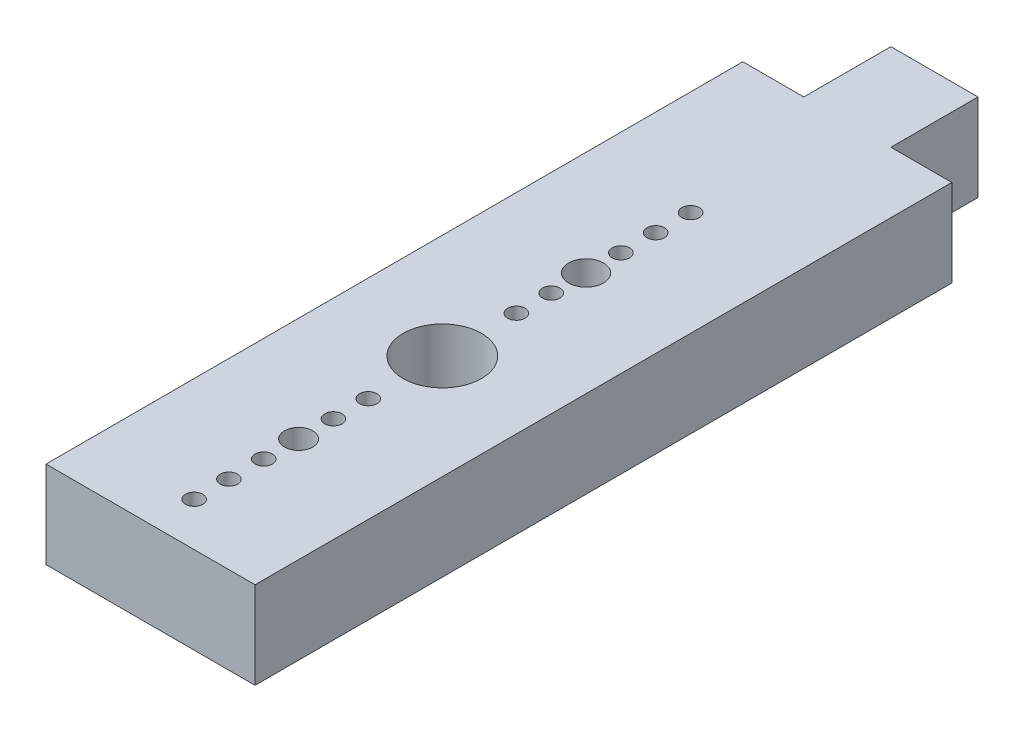
from build123d import *

# Parameters (mm, degrees)
SKETCH1_R           = 0.5
SKETCH1_R_2         = 2.25
SKETCH1_R_3         = 1
SKETCH1_R_4         = 0.811190326
BOSS_EXTRUDE1_DEPTH = 5


with BuildPart() as part:
    # Sketch1 → Boss-Extrude1 (new body)
    with BuildSketch(Plane(origin=(0, 0, 0), x_dir=(1, 0, 0), z_dir=(0, 1, 0))):
        Polygon((-2.5, 20), (-2.5, 25), (2.5, 25), (2.5, 20), (6, 20), (6, -20), (-6, -20), (-6, 20), align=None)
        with Locations(Location((0, 11, 0), (0, 0, 270))):
            Circle(SKETCH1_R, mode=Mode.SUBTRACT)
        with Locations(Location((0, 9, 0), (0, 0, 270))):
            Circle(SKETCH1_R, mode=Mode.SUBTRACT)
        with Locations(Location((0, 7, 0), (0, 0, 270))):
            Circle(SKETCH1_R, mode=Mode.SUBTRACT)
        with Locations(Location((0, 3, 0), (0, 0, 270))):
            Circle(SKETCH1_R, mode=Mode.SUBTRACT)
        with Locations(Location((0, 1, 0), (0, 0, 270))):
            Circle(SKETCH1_R, mode=Mode.SUBTRACT)
        with Locations(Location((0, -7.5, 0), (0, 0, 270))):
            Circle(SKETCH1_R, mode=Mode.SUBTRACT)
        with Locations(Location((0, -9.5, 0), (0, 0, 270))):
            Circle(SKETCH1_R, mode=Mode.SUBTRACT)
        with Locations(Location((0, -13.5, 0), (0, 0, 270))):
            Circle(SKETCH1_R, mode=Mode.SUBTRACT)
        with Locations(Location((0, -15.5, 0), (0, 0, 270))):
            Circle(SKETCH1_R, mode=Mode.SUBTRACT)
        with Locations(Location((0, -17.5, 0), (0, 0, 270))):
            Circle(SKETCH1_R, mode=Mode.SUBTRACT)
        with Locations(Location((0, -3.25, 0), (0, 0, 270))):
            Circle(SKETCH1_R_2, mode=Mode.SUBTRACT)
        with Locations(Location((0, 5, 0), (0, 0, 270))):
            Circle(SKETCH1_R_3, mode=Mode.SUBTRACT)
        with Locations(Location((0, -11.5, 0), (0, 0, 270))):
            Circle(SKETCH1_R_4, mode=Mode.SUBTRACT)
    extrude(amount=BOSS_EXTRUDE1_DEPTH)


solid = part.part
